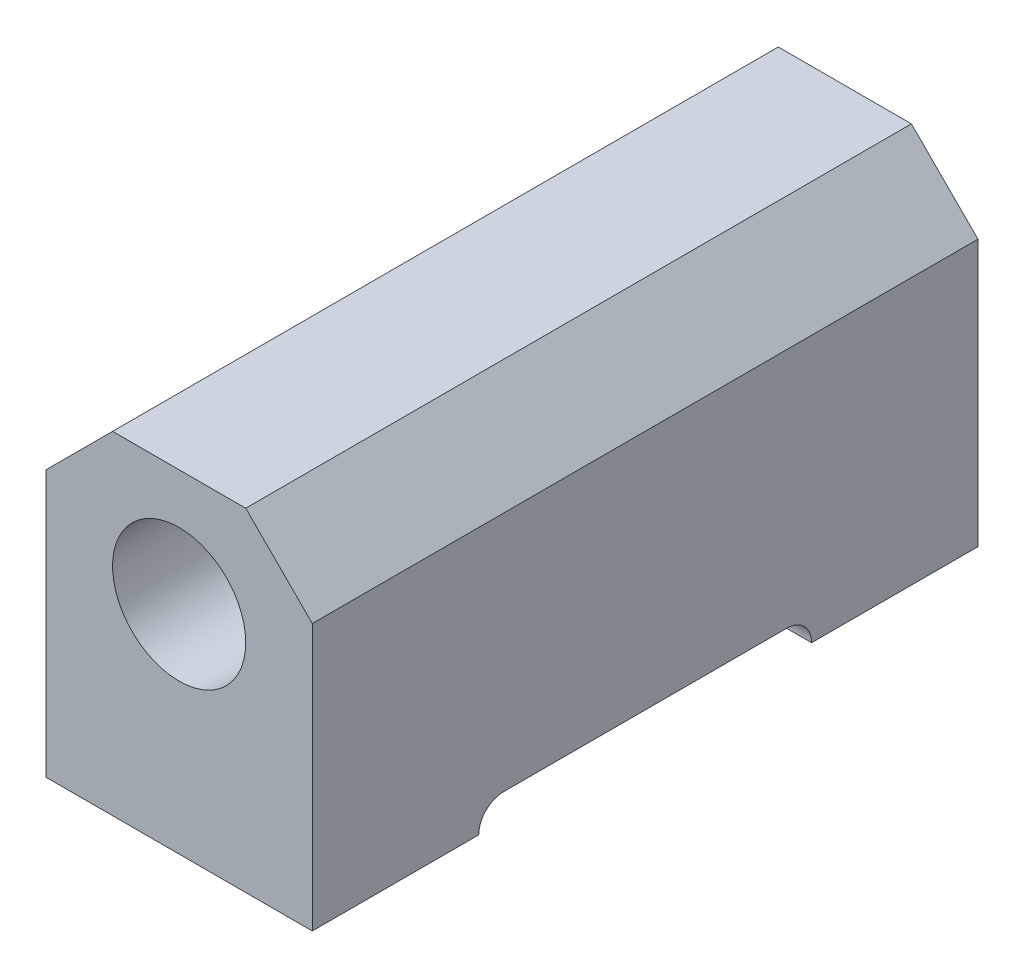
from build123d import *

# Parameters (mm, degrees)
BOSS_EXTRU_1_DEPTH           = 80
ENL_V_MAT_EXTRU_1_DEPTH      = 95.994736696
D_GAGEMENT_M11_D             = 16
D_GAGEMENT_M11_DEPTH         = 72
D_GAGEMENT_M11_TIP           = 4.618802154
ENL_V_MAT_EXTRU_2_REACH      = 91.582
ENL_V_MAT_EXTRU_2_END_RADIUS = 8
ESQUISSE3_R                  = 5
ENL_V_MAT_EXTRU_3_REACH      = 92.863
ENL_V_MAT_EXTRU_3_END_RADIUS = 8
ESQUISSE7_R                  = 2


with BuildPart() as part:
    # Esquisse1 → Boss.-Extru.1 (new body)
    with BuildSketch(Plane.XY):
        Polygon((-16, 0), (16, 0), (16, 32), (8, 40), (-8, 40), (-16, 32), align=None)
    extrude(amount=BOSS_EXTRU_1_DEPTH)

    # Esquisse2 → Enlèv. mat.-Extru.1 (cut, through all)
    with BuildSketch(Plane(origin=(16, 0, 0), x_dir=(0, 0, -1), z_dir=(1, 0, 0))):
        with BuildLine():
            Line((-60, -3), (-60, 0))
            ThreePointArc((-60, 0), (-59.121320344, 2.121320344), (-57, 3))
            Line((-57, 3), (-23, 3))
            ThreePointArc((-23, 3), (-20.878679656, 2.121320344), (-20, 0))
            Line((-20, 0), (-20, -3))
            Line((-20, -3), (-60, -3))
        make_face()
    extrude(amount=-ENL_V_MAT_EXTRU_1_DEPTH, mode=Mode.SUBTRACT)

    # Dégagement M11
    with Locations(Plane.XY.offset(80)):
        with Locations((0, 26)):
            Hole(D_GAGEMENT_M11_D / 2, depth=D_GAGEMENT_M11_DEPTH)
            with Locations((0, 0, -(D_GAGEMENT_M11_DEPTH + D_GAGEMENT_M11_TIP / 2))):  # 120° drill point
                Cone(0, D_GAGEMENT_M11_D / 2, D_GAGEMENT_M11_TIP, mode=Mode.SUBTRACT)

    # Enlèv. mat.-Extru.2: up to this cylinder (the profile starts outside it)
    enl_v_mat_extru_2_end = Plane(origin=(0, 26, 40), z_dir=(0, 0, 1)) * Cylinder(ENL_V_MAT_EXTRU_2_END_RADIUS, 200.164, mode=Mode.PRIVATE)
    # Esquisse3 → Enlèv. mat.-Extru.2 (cut, up to the surface)
    with BuildSketch(Plane.XZ.offset(-3), mode=Mode.PRIVATE) as enl_v_mat_extru_2_sk1:
        with Locations(Location((0, 40, 0), (0, 0, 270))):
            Circle(ESQUISSE3_R)
    enl_v_mat_extru_2_tool1 = extrude(enl_v_mat_extru_2_sk1.sketch, amount=-ENL_V_MAT_EXTRU_2_REACH, mode=Mode.PRIVATE) - enl_v_mat_extru_2_end
    add(enl_v_mat_extru_2_tool1.solids().sort_by_distance((0, 3, 40))[0], mode=Mode.SUBTRACT)

    # Enlèv. mat.-Extru.3: up to this cylinder (the profile starts outside it)
    enl_v_mat_extru_3_end = Plane(origin=(0, 26, 10), z_dir=(0, 0, 1)) * Cylinder(ENL_V_MAT_EXTRU_3_END_RADIUS, 202.726, mode=Mode.PRIVATE)
    # Esquisse7 → Enlèv. mat.-Extru.3 (cut, up to the surface)
    with BuildSketch(Plane.XZ, mode=Mode.PRIVATE) as enl_v_mat_extru_3_sk1:
        with Locations(Location((0, 10, 0), (0, 0, 270))):
            Circle(ESQUISSE7_R)
    enl_v_mat_extru_3_tool1 = extrude(enl_v_mat_extru_3_sk1.sketch, amount=-ENL_V_MAT_EXTRU_3_REACH, mode=Mode.PRIVATE) - enl_v_mat_extru_3_end
    add(enl_v_mat_extru_3_tool1.solids().sort_by_distance((0, 0, 10))[0], mode=Mode.SUBTRACT)


solid = part.part
